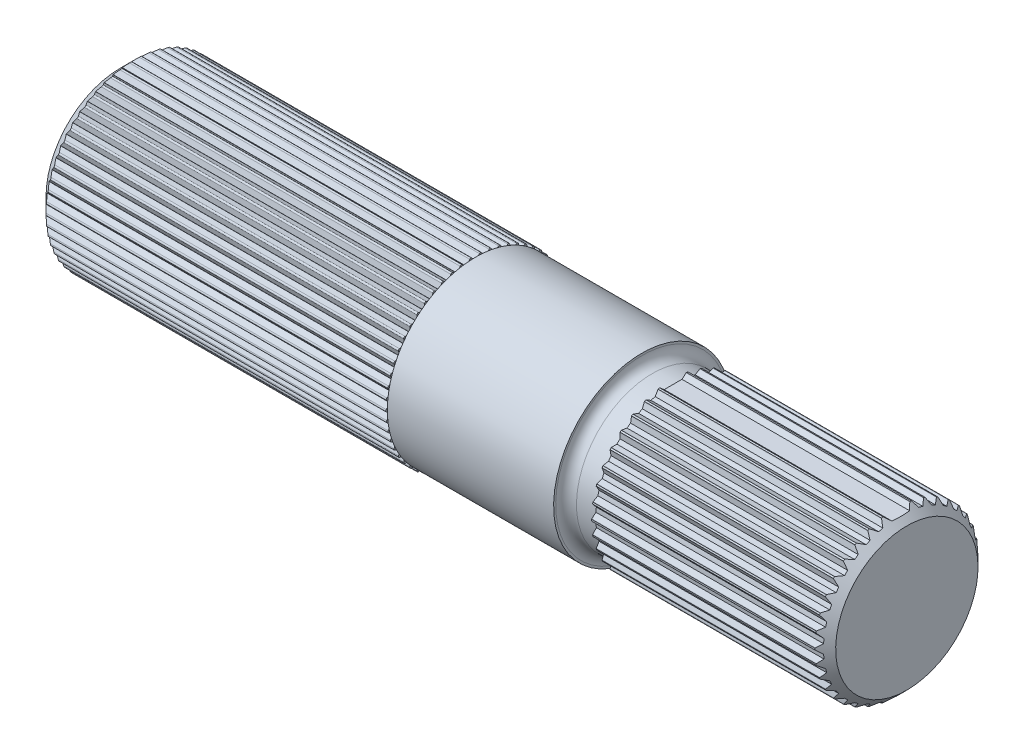
from build123d import *

# Parameters (mm, degrees)
IZIM2_OUTSIDE_W       = 35.232
IZIM2_OUTSIDE_H       = 35.232
KES_EKSTR_ZYON1_DEPTH = 23
IZIM4_OUTSIDE_W       = 35.232
IZIM4_OUTSIDE_H       = 35.232
KES_EKSTR_ZYON3_DEPTH = 34.2


with BuildPart() as part:
    # Çizim1 → Döndür1 (revolve)
    with BuildSketch(Plane.XY):
        with BuildLine():
            Line((0, 0), (75.7, 0))
            Line((75.7, 0), (75.7, -6.85))
            Line((75.7, -6.85), (74.7, -7.85))
            Line((74.7, -7.85), (53.2, -7.85))
            Line((53.2, -7.85), (53.2, -7.3))
            Line((53.2, -7.3), (51.2, -7.3))
            ThreePointArc((51.2, -7.3), (50.492893219, -7.592893219), (50.2, -8.3))
            Line((50.2, -8.3), (50.2, -8.5))
            Line((50.2, -8.5), (34.2, -8.5))
            Line((34.2, -8.5), (34.2, -8.66))
            Line((34.2, -8.66), (1.5, -8.66))
            Line((1.5, -8.66), (0, -7.16))
            Line((0, -7.16), (0, 0))
        make_face()
    revolve(axis=Axis((0, 0, 0), (1, 0, 0)))

    # Çizim2 outside → Kes-Ekstrüzyon1 (cut)
    with BuildSketch(Plane(origin=(75.7, 0, 0), x_dir=(0, 0, -1), z_dir=(1, 0, 0))):
        Rectangle(IZIM2_OUTSIDE_W, IZIM2_OUTSIDE_H)
        with BuildLine():
            Line((5.932852577, 5.108414624), (5.40374633, 5.108414624))
            ThreePointArc((5.40374633, 5.108414624), (5.258154352, 5.258154352), (5.108414624, 5.40374633))
            Line((5.108414624, 5.40374633), (5.108414624, 5.932852577))
            ThreePointArc((5.108414624, 5.932852577), (5.061919783, 6.032561087), (4.955652325, 6.061035366))
            Line((4.955652325, 6.061035366), (4.434584391, 5.96915703))
            ThreePointArc((4.434584391, 5.96915703), (4.265202251, 6.091340093), (4.092455625, 6.208718171))
            Line((4.092455625, 6.208718171), (4.000577289, 6.729786106))
            ThreePointArc((4.000577289, 6.729786106), (3.937474608, 6.819906075), (3.827877085, 6.829494615))
            Line((3.827877085, 6.829494615), (3.330679849, 6.648529621))
            ThreePointArc((3.330679849, 6.648529621), (3.142654138, 6.739443548), (2.952149432, 6.825041253))
            Line((2.952149432, 6.825041253), (2.771184438, 7.322238489))
            ThreePointArc((2.771184438, 7.322238489), (2.69339126, 7.400031667), (2.583793737, 7.390443126))
            Line((2.583793737, 7.390443126), (2.125574285, 7.125890003))
            ThreePointArc((2.125574285, 7.125890003), (1.92461807, 7.182772421), (1.722143673, 7.23398891))
            Line((1.722143673, 7.23398891), (1.457590549, 7.692208361))
            ThreePointArc((1.457590549, 7.692208361), (1.367470581, 7.755311042), (1.261203123, 7.726836763))
            Line((1.261203123, 7.726836763), (0.855884222, 7.386733823))
            Line((0.855884222, 7.386733823), (-0.855884222, 7.386733823))
            Line((-0.855884222, 7.386733823), (-1.261203123, 7.726836763))
            ThreePointArc((-1.261203123, 7.726836763), (-1.367470581, 7.755311042), (-1.457590549, 7.692208361))
            Line((-1.457590549, 7.692208361), (-1.722143673, 7.23398891))
            ThreePointArc((-1.722143673, 7.23398891), (-1.92461807, 7.182772421), (-2.125574285, 7.125890003))
            Line((-2.125574285, 7.125890003), (-2.583793737, 7.390443126))
            ThreePointArc((-2.583793737, 7.390443126), (-2.69339126, 7.400031667), (-2.771184438, 7.322238489))
            Line((-2.771184438, 7.322238489), (-2.952149432, 6.825041253))
            ThreePointArc((-2.952149432, 6.825041253), (-3.142654138, 6.739443548), (-3.330679849, 6.648529621))
            Line((-3.330679849, 6.648529621), (-3.827877085, 6.829494615))
            ThreePointArc((-3.827877085, 6.829494615), (-3.937474608, 6.819906075), (-4.000577289, 6.729786106))
            Line((-4.000577289, 6.729786106), (-4.092455625, 6.208718171))
            ThreePointArc((-4.092455625, 6.208718171), (-4.265202251, 6.091340093), (-4.434584391, 5.96915703))
            Line((-4.434584391, 5.96915703), (-4.955652325, 6.061035366))
            ThreePointArc((-4.955652325, 6.061035366), (-5.061919783, 6.032561087), (-5.108414624, 5.932852577))
            Line((-5.108414624, 5.932852577), (-5.108414624, 5.40374633))
            ThreePointArc((-5.108414624, 5.40374633), (-5.258154352, 5.258154352), (-5.40374633, 5.108414624))
            Line((-5.40374633, 5.108414624), (-5.932852577, 5.108414624))
            ThreePointArc((-5.932852577, 5.108414624), (-6.032561087, 5.061919783), (-6.061035366, 4.955652325))
            Line((-6.061035366, 4.955652325), (-5.96915703, 4.434584391))
            ThreePointArc((-5.96915703, 4.434584391), (-6.091340093, 4.265202251), (-6.208718171, 4.092455625))
            Line((-6.208718171, 4.092455625), (-6.729786106, 4.000577289))
            ThreePointArc((-6.729786106, 4.000577289), (-6.819906075, 3.937474608), (-6.829494615, 3.827877085))
            Line((-6.829494615, 3.827877085), (-6.648529621, 3.330679849))
            ThreePointArc((-6.648529621, 3.330679849), (-6.739443548, 3.142654138), (-6.825041253, 2.952149432))
            Line((-6.825041253, 2.952149432), (-7.322238489, 2.771184438))
            ThreePointArc((-7.322238489, 2.771184438), (-7.400031667, 2.69339126), (-7.390443126, 2.583793737))
            Line((-7.390443126, 2.583793737), (-7.125890003, 2.125574285))
            ThreePointArc((-7.125890003, 2.125574285), (-7.182772421, 1.92461807), (-7.23398891, 1.722143673))
            Line((-7.23398891, 1.722143673), (-7.692208361, 1.457590549))
            ThreePointArc((-7.692208361, 1.457590549), (-7.755311042, 1.367470581), (-7.726836763, 1.261203123))
            Line((-7.726836763, 1.261203123), (-7.386733823, 0.855884222))
            ThreePointArc((-7.386733823, 0.855884222), (-7.407856389, 0.648103455), (-7.423135474, 0.439811449))
            Line((-7.423135474, 0.439811449), (-7.828454374, 0.099708509))
            ThreePointArc((-7.828454374, 0.099708509), (-7.874949216, 0), (-7.828454374, -0.099708509))
            Line((-7.828454374, -0.099708509), (-7.423135474, -0.439811449))
            ThreePointArc((-7.423135474, -0.439811449), (-7.407856389, -0.648103455), (-7.386733823, -0.855884222))
            Line((-7.386733823, -0.855884222), (-7.726836763, -1.261203123))
            ThreePointArc((-7.726836763, -1.261203123), (-7.755311042, -1.367470581), (-7.692208361, -1.457590549))
            Line((-7.692208361, -1.457590549), (-7.23398891, -1.722143673))
            ThreePointArc((-7.23398891, -1.722143673), (-7.182772421, -1.92461807), (-7.125890003, -2.125574285))
            Line((-7.125890003, -2.125574285), (-7.390443126, -2.583793737))
            ThreePointArc((-7.390443126, -2.583793737), (-7.400031667, -2.69339126), (-7.322238489, -2.771184438))
            Line((-7.322238489, -2.771184438), (-6.825041253, -2.952149432))
            ThreePointArc((-6.825041253, -2.952149432), (-6.739443548, -3.142654138), (-6.648529621, -3.330679849))
            Line((-6.648529621, -3.330679849), (-6.829494615, -3.827877085))
            ThreePointArc((-6.829494615, -3.827877085), (-6.819906075, -3.937474608), (-6.729786106, -4.000577289))
            Line((-6.729786106, -4.000577289), (-6.208718171, -4.092455625))
            ThreePointArc((-6.208718171, -4.092455625), (-6.091340093, -4.265202251), (-5.96915703, -4.434584391))
            Line((-5.96915703, -4.434584391), (-6.061035366, -4.955652325))
            ThreePointArc((-6.061035366, -4.955652325), (-6.032561087, -5.061919783), (-5.932852577, -5.108414624))
            Line((-5.932852577, -5.108414624), (-5.40374633, -5.108414624))
            ThreePointArc((-5.40374633, -5.108414624), (-5.258154352, -5.258154352), (-5.108414624, -5.40374633))
            Line((-5.108414624, -5.40374633), (-5.108414624, -5.932852577))
            ThreePointArc((-5.108414624, -5.932852577), (-5.061919783, -6.032561087), (-4.955652325, -6.061035366))
            Line((-4.955652325, -6.061035366), (-4.434584391, -5.96915703))
            ThreePointArc((-4.434584391, -5.96915703), (-4.265202251, -6.091340093), (-4.092455625, -6.208718171))
            Line((-4.092455625, -6.208718171), (-4.000577289, -6.729786106))
            ThreePointArc((-4.000577289, -6.729786106), (-3.937474608, -6.819906075), (-3.827877085, -6.829494615))
            Line((-3.827877085, -6.829494615), (-3.330679849, -6.648529621))
            ThreePointArc((-3.330679849, -6.648529621), (-3.142654138, -6.739443548), (-2.952149432, -6.825041253))
            Line((-2.952149432, -6.825041253), (-2.771184438, -7.322238489))
            ThreePointArc((-2.771184438, -7.322238489), (-2.69339126, -7.400031667), (-2.583793737, -7.390443126))
            Line((-2.583793737, -7.390443126), (-2.125574285, -7.125890003))
            ThreePointArc((-2.125574285, -7.125890003), (-1.92461807, -7.182772421), (-1.722143673, -7.23398891))
            Line((-1.722143673, -7.23398891), (-1.457590549, -7.692208361))
            ThreePointArc((-1.457590549, -7.692208361), (-1.367470581, -7.755311042), (-1.261203123, -7.726836763))
            Line((-1.261203123, -7.726836763), (-0.855884222, -7.386733823))
            ThreePointArc((-0.855884222, -7.386733823), (-0.648103455, -7.407856389), (-0.439811449, -7.423135474))
            Line((-0.439811449, -7.423135474), (-0.099708509, -7.828454374))
            ThreePointArc((-0.099708509, -7.828454374), (0, -7.874949216), (0.099708509, -7.828454374))
            Line((0.099708509, -7.828454374), (0.439811449, -7.423135474))
            ThreePointArc((0.439811449, -7.423135474), (0.648103455, -7.407856389), (0.855884222, -7.386733823))
            Line((0.855884222, -7.386733823), (1.261203123, -7.726836763))
            ThreePointArc((1.261203123, -7.726836763), (1.367470581, -7.755311042), (1.457590549, -7.692208361))
            Line((1.457590549, -7.692208361), (1.722143673, -7.23398891))
            ThreePointArc((1.722143673, -7.23398891), (1.92461807, -7.182772421), (2.125574285, -7.125890003))
            Line((2.125574285, -7.125890003), (2.583793737, -7.390443126))
            ThreePointArc((2.583793737, -7.390443126), (2.69339126, -7.400031667), (2.771184438, -7.322238489))
            Line((2.771184438, -7.322238489), (2.952149432, -6.825041253))
            ThreePointArc((2.952149432, -6.825041253), (3.142654138, -6.739443548), (3.330679849, -6.648529621))
            Line((3.330679849, -6.648529621), (3.827877085, -6.829494615))
            ThreePointArc((3.827877085, -6.829494615), (3.937474608, -6.819906075), (4.000577289, -6.729786106))
            Line((4.000577289, -6.729786106), (4.092455625, -6.208718171))
            ThreePointArc((4.092455625, -6.208718171), (4.265202251, -6.091340093), (4.434584391, -5.96915703))
            Line((4.434584391, -5.96915703), (4.955652325, -6.061035366))
            ThreePointArc((4.955652325, -6.061035366), (5.061919783, -6.032561087), (5.108414624, -5.932852577))
            Line((5.108414624, -5.932852577), (5.108414624, -5.40374633))
            ThreePointArc((5.108414624, -5.40374633), (5.258154352, -5.258154352), (5.40374633, -5.108414624))
            Line((5.40374633, -5.108414624), (5.932852577, -5.108414624))
            ThreePointArc((5.932852577, -5.108414624), (6.032561087, -5.061919783), (6.061035366, -4.955652325))
            Line((6.061035366, -4.955652325), (5.96915703, -4.434584391))
            ThreePointArc((5.96915703, -4.434584391), (6.091340093, -4.265202251), (6.208718171, -4.092455625))
            Line((6.208718171, -4.092455625), (6.729786106, -4.000577289))
            ThreePointArc((6.729786106, -4.000577289), (6.819906075, -3.937474608), (6.829494615, -3.827877085))
            Line((6.829494615, -3.827877085), (6.648529621, -3.330679849))
            ThreePointArc((6.648529621, -3.330679849), (6.739443548, -3.142654138), (6.825041253, -2.952149432))
            Line((6.825041253, -2.952149432), (7.322238489, -2.771184438))
            ThreePointArc((7.322238489, -2.771184438), (7.400031667, -2.69339126), (7.390443126, -2.583793737))
            Line((7.390443126, -2.583793737), (7.125890003, -2.125574285))
            ThreePointArc((7.125890003, -2.125574285), (7.182772421, -1.92461807), (7.23398891, -1.722143673))
            Line((7.23398891, -1.722143673), (7.692208361, -1.457590549))
            ThreePointArc((7.692208361, -1.457590549), (7.755311042, -1.367470581), (7.726836763, -1.261203123))
            Line((7.726836763, -1.261203123), (7.386733823, -0.855884222))
            ThreePointArc((7.386733823, -0.855884222), (7.407856389, -0.648103455), (7.423135474, -0.439811449))
            Line((7.423135474, -0.439811449), (7.828454374, -0.099708509))
            ThreePointArc((7.828454374, -0.099708509), (7.874949216, 0), (7.828454374, 0.099708509))
            Line((7.828454374, 0.099708509), (7.423135474, 0.439811449))
            ThreePointArc((7.423135474, 0.439811449), (7.407856389, 0.648103455), (7.386733823, 0.855884222))
            Line((7.386733823, 0.855884222), (7.726836763, 1.261203123))
            ThreePointArc((7.726836763, 1.261203123), (7.755311042, 1.367470581), (7.692208361, 1.457590549))
            Line((7.692208361, 1.457590549), (7.23398891, 1.722143673))
            ThreePointArc((7.23398891, 1.722143673), (7.182772421, 1.92461807), (7.125890003, 2.125574285))
            Line((7.125890003, 2.125574285), (7.390443126, 2.583793737))
            ThreePointArc((7.390443126, 2.583793737), (7.400031667, 2.69339126), (7.322238489, 2.771184438))
            Line((7.322238489, 2.771184438), (6.825041253, 2.952149432))
            ThreePointArc((6.825041253, 2.952149432), (6.739443548, 3.142654138), (6.648529621, 3.330679849))
            Line((6.648529621, 3.330679849), (6.829494615, 3.827877085))
            ThreePointArc((6.829494615, 3.827877085), (6.819906075, 3.937474608), (6.729786106, 4.000577289))
            Line((6.729786106, 4.000577289), (6.208718171, 4.092455625))
            ThreePointArc((6.208718171, 4.092455625), (6.091340093, 4.265202251), (5.96915703, 4.434584391))
            Line((5.96915703, 4.434584391), (6.061035366, 4.955652325))
            ThreePointArc((6.061035366, 4.955652325), (6.032561087, 5.061919783), (5.932852577, 5.108414624))
        make_face(mode=Mode.SUBTRACT)
    extrude(amount=-KES_EKSTR_ZYON1_DEPTH, mode=Mode.SUBTRACT)

    # Çizim4 outside → Kes-Ekstrüzyon3 (cut)
    with BuildSketch(Plane.ZY):
        Rectangle(IZIM4_OUTSIDE_W, IZIM4_OUTSIDE_H)
        with BuildLine():
            Line((-0.36676349, 8.606270821), (-0.005215817, 8.219959157))
            ThreePointArc((-0.005215817, 8.219959157), (0, 8.219960812), (0.005215817, 8.219959157))
            Line((0.005215817, 8.219959157), (0.36676349, 8.606270821))
            ThreePointArc((0.36676349, 8.606270821), (0.468842948, 8.647299364), (0.565888047, 8.595474601))
            Line((0.565888047, 8.595474601), (0.883548673, 8.172337334))
            ThreePointArc((0.883548673, 8.172337334), (0.888734095, 8.17177505), (0.893919158, 8.171209476))
            Line((0.893919158, 8.171209476), (1.29511506, 8.516166384))
            ThreePointArc((1.29511506, 8.516166384), (1.40103209, 8.545917685), (1.491905063, 8.483904301))
            Line((1.491905063, 8.483904301), (1.761954364, 8.028902327))
            ThreePointArc((1.761954364, 8.028902327), (1.767048594, 8.027782696), (1.772142113, 8.026659834))
            Line((1.772142113, 8.026659834), (2.208282591, 8.326217683))
            ThreePointArc((2.208282591, 8.326217683), (2.316795412, 8.344342935), (2.400430857, 8.272867979))
            Line((2.400430857, 8.272867979), (2.619702751, 7.791335781))
            ThreePointArc((2.619702751, 7.791335781), (2.624646065, 7.789671931), (2.629588323, 7.788004944))
            Line((2.629588323, 7.788004944), (3.095560026, 8.038651692))
            ThreePointArc((3.095560026, 8.038651692), (3.205396425, 8.044938394), (3.280813794, 7.964839845))
            Line((3.280813794, 7.964839845), (3.446737518, 7.462422947))
            ThreePointArc((3.446737518, 7.462422947), (3.45147196, 7.460234384), (3.456205013, 7.458042817))
            Line((3.456205013, 7.458042817), (3.946544851, 7.65683986))
            ThreePointArc((3.946544851, 7.65683986), (4.056417096, 7.651214305), (4.122732189, 7.563431245))
            Line((4.122732189, 7.563431245), (4.233362439, 7.046020027))
            ThreePointArc((4.233362439, 7.046020027), (4.237832503, 7.04333241), (4.24230086, 7.040641957))
            Line((4.24230086, 7.040641957), (4.751260046, 7.185258581))
            ThreePointArc((4.751260046, 7.185258581), (4.859879986, 7.167786724), (4.916315319, 7.07334833))
            Line((4.916315319, 7.07334833), (4.970355056, 6.547008964))
            ThreePointArc((4.970355056, 6.547008964), (4.974508333, 6.543853803), (4.978659608, 6.540696007))
            Line((4.978659608, 6.540696007), (5.500271061, 6.629436715))
            ThreePointArc((5.500271061, 6.629436715), (5.606365226, 6.600323397), (5.652259146, 6.500336872))
            Line((5.652259146, 6.500336872), (5.649074804, 5.971240207))
            ThreePointArc((5.649074804, 5.971240207), (5.652862602, 5.967654493), (5.656648124, 5.964066377))
            Line((5.656648124, 5.964066377), (6.184796427, 5.995890765))
            ThreePointArc((6.184796427, 5.995890765), (6.28712096, 5.955477314), (6.321935403, 5.851114908))
            Line((6.321935403, 5.851114908), (6.261564316, 5.325464118))
            ThreePointArc((6.261564316, 5.325464118), (6.264942226, 5.321489891), (6.268317613, 5.317513522))
            Line((6.268317613, 5.317513522), (6.796810709, 5.292048477))
            ThreePointArc((6.796810709, 5.292048477), (6.894165949, 5.240808704), (6.917492747, 5.133293972))
            Line((6.917492747, 5.133293972), (6.800642711, 4.617251832))
            ThreePointArc((6.800642711, 4.617251832), (6.80357113, 4.612935686), (6.806496809, 4.608617682))
            Line((6.806496809, 4.608617682), (7.3291386, 4.52616176))
            ThreePointArc((7.3291386, 4.52616176), (7.420383146, 4.464696403), (7.431948814, 4.355289857))
            Line((7.431948814, 4.355289857), (7.259989788, 3.854906489))
            ThreePointArc((7.259989788, 3.854906489), (7.262434382, 3.850299027), (7.264876053, 3.845690014))
            Line((7.264876053, 3.845690014), (7.775539043, 3.707209934))
            ThreePointArc((7.775539043, 3.707209934), (7.859603134, 3.63623962), (7.859272075, 3.52622395))
            Line((7.859272075, 3.52622395), (7.634220122, 3.047365893))
            ThreePointArc((7.634220122, 3.047365893), (7.636152232, 3.042521132), (7.638081268, 3.037675146))
            Line((7.638081268, 3.037675146), (8.130778399, 2.844794462))
            ThreePointArc((8.130778399, 2.844794462), (8.206676462, 2.765151251), (8.194452558, 2.655816292))
            Line((8.194452558, 2.655816292), (7.918946206, 2.204097717))
            ThreePointArc((7.918946206, 2.204097717), (7.920343179, 2.199072459), (7.921736964, 2.194046315))
            Line((7.921736964, 2.194046315), (8.390691812, 1.949026375))
            ThreePointArc((8.390691812, 1.949026375), (8.457534012, 1.861644012), (8.433560577, 1.754271616))
            Line((8.433560577, 1.754271616), (8.110829885, 1.334988511))
            ThreePointArc((8.110829885, 1.334988511), (8.111675344, 1.329841672), (8.112517536, 1.324694297))
            Line((8.112517536, 1.324694297), (8.552232036, 1.030407737))
            ThreePointArc((8.552232036, 1.030407737), (8.609234709, 0.9363107), (8.573792808, 0.832159709))
            Line((8.573792808, 0.832159709), (8.207621501, 0.450227785))
            ThreePointArc((8.207621501, 0.450227785), (8.207905532, 0.445019707), (8.208186258, 0.439811449))
            Line((8.208186258, 0.439811449), (8.613505159, 0.099708509))
            ThreePointArc((8.613505159, 0.099708509), (8.66, 0), (8.613505159, -0.099708509))
            Line((8.613505159, -0.099708509), (8.208186258, -0.439811449))
            ThreePointArc((8.208186258, -0.439811449), (8.207905532, -0.445019707), (8.207621501, -0.450227785))
            Line((8.207621501, -0.450227785), (8.573792808, -0.832159709))
            ThreePointArc((8.573792808, -0.832159709), (8.609234709, -0.9363107), (8.552232036, -1.030407737))
            Line((8.552232036, -1.030407737), (8.112517536, -1.324694297))
            ThreePointArc((8.112517536, -1.324694297), (8.111675344, -1.329841672), (8.110829885, -1.334988511))
            Line((8.110829885, -1.334988511), (8.433560577, -1.754271616))
            ThreePointArc((8.433560577, -1.754271616), (8.457534012, -1.861644012), (8.390691812, -1.949026375))
            Line((8.390691812, -1.949026375), (7.921736964, -2.194046315))
            ThreePointArc((7.921736964, -2.194046315), (7.920343179, -2.199072459), (7.918946206, -2.204097717))
            Line((7.918946206, -2.204097717), (8.194452558, -2.655816292))
            ThreePointArc((8.194452558, -2.655816292), (8.206676462, -2.765151251), (8.130778399, -2.844794462))
            Line((8.130778399, -2.844794462), (7.638081268, -3.037675146))
            ThreePointArc((7.638081268, -3.037675146), (7.636152232, -3.042521132), (7.634220122, -3.047365893))
            Line((7.634220122, -3.047365893), (7.859272075, -3.52622395))
            ThreePointArc((7.859272075, -3.52622395), (7.859603134, -3.63623962), (7.775539043, -3.707209934))
            Line((7.775539043, -3.707209934), (7.264876053, -3.845690014))
            ThreePointArc((7.264876053, -3.845690014), (7.262434382, -3.850299027), (7.259989788, -3.854906489))
            Line((7.259989788, -3.854906489), (7.431948814, -4.355289857))
            ThreePointArc((7.431948814, -4.355289857), (7.420383146, -4.464696403), (7.3291386, -4.52616176))
            Line((7.3291386, -4.52616176), (6.806496809, -4.608617682))
            ThreePointArc((6.806496809, -4.608617682), (6.80357113, -4.612935686), (6.800642711, -4.617251832))
            Line((6.800642711, -4.617251832), (6.917492747, -5.133293972))
            ThreePointArc((6.917492747, -5.133293972), (6.894165949, -5.240808704), (6.796810709, -5.292048477))
            Line((6.796810709, -5.292048477), (6.268317613, -5.317513522))
            ThreePointArc((6.268317613, -5.317513522), (6.264942226, -5.321489891), (6.261564316, -5.325464118))
            Line((6.261564316, -5.325464118), (6.321935403, -5.851114908))
            ThreePointArc((6.321935403, -5.851114908), (6.28712096, -5.955477314), (6.184796427, -5.995890765))
            Line((6.184796427, -5.995890765), (5.656648124, -5.964066377))
            ThreePointArc((5.656648124, -5.964066377), (5.652862602, -5.967654493), (5.649074804, -5.971240207))
            Line((5.649074804, -5.971240207), (5.652259146, -6.500336872))
            ThreePointArc((5.652259146, -6.500336872), (5.606365226, -6.600323397), (5.500271061, -6.629436715))
            Line((5.500271061, -6.629436715), (4.978659608, -6.540696007))
            ThreePointArc((4.978659608, -6.540696007), (4.974508333, -6.543853803), (4.970355056, -6.547008964))
            Line((4.970355056, -6.547008964), (4.916315319, -7.07334833))
            ThreePointArc((4.916315319, -7.07334833), (4.859879986, -7.167786724), (4.751260046, -7.185258581))
            Line((4.751260046, -7.185258581), (4.24230086, -7.040641957))
            ThreePointArc((4.24230086, -7.040641957), (4.237832503, -7.04333241), (4.233362439, -7.046020027))
            Line((4.233362439, -7.046020027), (4.122732189, -7.563431245))
            ThreePointArc((4.122732189, -7.563431245), (4.056417096, -7.651214305), (3.946544851, -7.65683986))
            Line((3.946544851, -7.65683986), (3.456205013, -7.458042817))
            ThreePointArc((3.456205013, -7.458042817), (3.45147196, -7.460234384), (3.446737518, -7.462422947))
            Line((3.446737518, -7.462422947), (3.280813794, -7.964839845))
            ThreePointArc((3.280813794, -7.964839845), (3.205396425, -8.044938394), (3.095560026, -8.038651692))
            Line((3.095560026, -8.038651692), (2.629588323, -7.788004944))
            ThreePointArc((2.629588323, -7.788004944), (2.624646065, -7.789671931), (2.619702751, -7.791335781))
            Line((2.619702751, -7.791335781), (2.400430857, -8.272867979))
            ThreePointArc((2.400430857, -8.272867979), (2.316795412, -8.344342935), (2.208282591, -8.326217683))
            Line((2.208282591, -8.326217683), (1.772142113, -8.026659834))
            ThreePointArc((1.772142113, -8.026659834), (1.767048594, -8.027782696), (1.761954364, -8.028902327))
            Line((1.761954364, -8.028902327), (1.491905063, -8.483904301))
            ThreePointArc((1.491905063, -8.483904301), (1.40103209, -8.545917685), (1.29511506, -8.516166384))
            Line((1.29511506, -8.516166384), (0.893919158, -8.171209476))
            ThreePointArc((0.893919158, -8.171209476), (0.888734095, -8.17177505), (0.883548673, -8.172337334))
            Line((0.883548673, -8.172337334), (0.565888047, -8.595474601))
            ThreePointArc((0.565888047, -8.595474601), (0.468842948, -8.647299364), (0.36676349, -8.606270821))
            Line((0.36676349, -8.606270821), (0.005215817, -8.219959157))
            ThreePointArc((0.005215817, -8.219959157), (0, -8.219960812), (-0.005215817, -8.219959157))
            Line((-0.005215817, -8.219959157), (-0.36676349, -8.606270821))
            ThreePointArc((-0.36676349, -8.606270821), (-0.468842948, -8.647299364), (-0.565888047, -8.595474601))
            Line((-0.565888047, -8.595474601), (-0.883548673, -8.172337334))
            ThreePointArc((-0.883548673, -8.172337334), (-0.888734095, -8.17177505), (-0.893919158, -8.171209476))
            Line((-0.893919158, -8.171209476), (-1.29511506, -8.516166384))
            ThreePointArc((-1.29511506, -8.516166384), (-1.40103209, -8.545917685), (-1.491905063, -8.483904301))
            Line((-1.491905063, -8.483904301), (-1.761954364, -8.028902327))
            ThreePointArc((-1.761954364, -8.028902327), (-1.767048594, -8.027782696), (-1.772142113, -8.026659834))
            Line((-1.772142113, -8.026659834), (-2.208282591, -8.326217683))
            ThreePointArc((-2.208282591, -8.326217683), (-2.316795412, -8.344342935), (-2.400430857, -8.272867979))
            Line((-2.400430857, -8.272867979), (-2.619702751, -7.791335781))
            ThreePointArc((-2.619702751, -7.791335781), (-2.624646065, -7.789671931), (-2.629588323, -7.788004944))
            Line((-2.629588323, -7.788004944), (-3.095560026, -8.038651692))
            ThreePointArc((-3.095560026, -8.038651692), (-3.205396425, -8.044938394), (-3.280813794, -7.964839845))
            Line((-3.280813794, -7.964839845), (-3.446737518, -7.462422947))
            ThreePointArc((-3.446737518, -7.462422947), (-3.45147196, -7.460234384), (-3.456205013, -7.458042817))
            Line((-3.456205013, -7.458042817), (-3.946544851, -7.65683986))
            ThreePointArc((-3.946544851, -7.65683986), (-4.056417096, -7.651214305), (-4.122732189, -7.563431245))
            Line((-4.122732189, -7.563431245), (-4.233362439, -7.046020027))
            ThreePointArc((-4.233362439, -7.046020027), (-4.237832503, -7.04333241), (-4.24230086, -7.040641957))
            Line((-4.24230086, -7.040641957), (-4.751260046, -7.185258581))
            ThreePointArc((-4.751260046, -7.185258581), (-4.859879986, -7.167786724), (-4.916315319, -7.07334833))
            Line((-4.916315319, -7.07334833), (-4.970355056, -6.547008964))
            ThreePointArc((-4.970355056, -6.547008964), (-4.974508333, -6.543853803), (-4.978659608, -6.540696007))
            Line((-4.978659608, -6.540696007), (-5.500271061, -6.629436715))
            ThreePointArc((-5.500271061, -6.629436715), (-5.606365226, -6.600323397), (-5.652259146, -6.500336872))
            Line((-5.652259146, -6.500336872), (-5.649074804, -5.971240207))
            ThreePointArc((-5.649074804, -5.971240207), (-5.652862602, -5.967654493), (-5.656648124, -5.964066377))
            Line((-5.656648124, -5.964066377), (-6.184796427, -5.995890765))
            ThreePointArc((-6.184796427, -5.995890765), (-6.28712096, -5.955477314), (-6.321935403, -5.851114908))
            Line((-6.321935403, -5.851114908), (-6.261564316, -5.325464118))
            ThreePointArc((-6.261564316, -5.325464118), (-6.264942226, -5.321489891), (-6.268317613, -5.317513522))
            Line((-6.268317613, -5.317513522), (-6.796810709, -5.292048477))
            ThreePointArc((-6.796810709, -5.292048477), (-6.894165949, -5.240808704), (-6.917492747, -5.133293972))
            Line((-6.917492747, -5.133293972), (-6.800642711, -4.617251832))
            ThreePointArc((-6.800642711, -4.617251832), (-6.80357113, -4.612935686), (-6.806496809, -4.608617682))
            Line((-6.806496809, -4.608617682), (-7.3291386, -4.52616176))
            ThreePointArc((-7.3291386, -4.52616176), (-7.420383146, -4.464696403), (-7.431948814, -4.355289857))
            Line((-7.431948814, -4.355289857), (-7.259989788, -3.854906489))
            ThreePointArc((-7.259989788, -3.854906489), (-7.262434382, -3.850299027), (-7.264876053, -3.845690014))
            Line((-7.264876053, -3.845690014), (-7.775539043, -3.707209934))
            ThreePointArc((-7.775539043, -3.707209934), (-7.859603134, -3.63623962), (-7.859272075, -3.52622395))
            Line((-7.859272075, -3.52622395), (-7.634220122, -3.047365893))
            ThreePointArc((-7.634220122, -3.047365893), (-7.636152232, -3.042521132), (-7.638081268, -3.037675146))
            Line((-7.638081268, -3.037675146), (-8.130778399, -2.844794462))
            ThreePointArc((-8.130778399, -2.844794462), (-8.206676462, -2.765151251), (-8.194452558, -2.655816292))
            Line((-8.194452558, -2.655816292), (-7.918946206, -2.204097717))
            ThreePointArc((-7.918946206, -2.204097717), (-7.920343179, -2.199072459), (-7.921736964, -2.194046315))
            Line((-7.921736964, -2.194046315), (-8.390691812, -1.949026375))
            ThreePointArc((-8.390691812, -1.949026375), (-8.457534012, -1.861644012), (-8.433560577, -1.754271616))
            Line((-8.433560577, -1.754271616), (-8.110829885, -1.334988511))
            ThreePointArc((-8.110829885, -1.334988511), (-8.111675344, -1.329841672), (-8.112517536, -1.324694297))
            Line((-8.112517536, -1.324694297), (-8.552232036, -1.030407737))
            ThreePointArc((-8.552232036, -1.030407737), (-8.609234709, -0.9363107), (-8.573792808, -0.832159709))
            Line((-8.573792808, -0.832159709), (-8.207621501, -0.450227785))
            ThreePointArc((-8.207621501, -0.450227785), (-8.207905532, -0.445019707), (-8.208186258, -0.439811449))
            Line((-8.208186258, -0.439811449), (-8.613505159, -0.099708509))
            ThreePointArc((-8.613505159, -0.099708509), (-8.66, 0), (-8.613505159, 0.099708509))
            Line((-8.613505159, 0.099708509), (-8.208186258, 0.439811449))
            ThreePointArc((-8.208186258, 0.439811449), (-8.207905532, 0.445019707), (-8.207621501, 0.450227785))
            Line((-8.207621501, 0.450227785), (-8.573792808, 0.832159709))
            ThreePointArc((-8.573792808, 0.832159709), (-8.609234709, 0.9363107), (-8.552232036, 1.030407737))
            Line((-8.552232036, 1.030407737), (-8.112517536, 1.324694297))
            ThreePointArc((-8.112517536, 1.324694297), (-8.111675344, 1.329841672), (-8.110829885, 1.334988511))
            Line((-8.110829885, 1.334988511), (-8.433560577, 1.754271616))
            ThreePointArc((-8.433560577, 1.754271616), (-8.457534012, 1.861644012), (-8.390691812, 1.949026375))
            Line((-8.390691812, 1.949026375), (-7.921736964, 2.194046315))
            ThreePointArc((-7.921736964, 2.194046315), (-7.920343179, 2.199072459), (-7.918946206, 2.204097717))
            Line((-7.918946206, 2.204097717), (-8.194452558, 2.655816292))
            ThreePointArc((-8.194452558, 2.655816292), (-8.206676462, 2.765151251), (-8.130778399, 2.844794462))
            Line((-8.130778399, 2.844794462), (-7.638081268, 3.037675146))
            ThreePointArc((-7.638081268, 3.037675146), (-7.636152232, 3.042521132), (-7.634220122, 3.047365893))
            Line((-7.634220122, 3.047365893), (-7.859272075, 3.52622395))
            ThreePointArc((-7.859272075, 3.52622395), (-7.859603134, 3.63623962), (-7.775539043, 3.707209934))
            Line((-7.775539043, 3.707209934), (-7.264876053, 3.845690014))
            ThreePointArc((-7.264876053, 3.845690014), (-7.262434382, 3.850299027), (-7.259989788, 3.854906489))
            Line((-7.259989788, 3.854906489), (-7.431948814, 4.355289857))
            ThreePointArc((-7.431948814, 4.355289857), (-7.420383146, 4.464696403), (-7.3291386, 4.52616176))
            Line((-7.3291386, 4.52616176), (-6.806496809, 4.608617682))
            ThreePointArc((-6.806496809, 4.608617682), (-6.80357113, 4.612935686), (-6.800642711, 4.617251832))
            Line((-6.800642711, 4.617251832), (-6.917492747, 5.133293972))
            ThreePointArc((-6.917492747, 5.133293972), (-6.894165949, 5.240808704), (-6.796810709, 5.292048477))
            Line((-6.796810709, 5.292048477), (-6.268317613, 5.317513522))
            ThreePointArc((-6.268317613, 5.317513522), (-6.264942226, 5.321489891), (-6.261564316, 5.325464118))
            Line((-6.261564316, 5.325464118), (-6.321935403, 5.851114908))
            ThreePointArc((-6.321935403, 5.851114908), (-6.28712096, 5.955477314), (-6.184796427, 5.995890765))
            Line((-6.184796427, 5.995890765), (-5.656648124, 5.964066377))
            ThreePointArc((-5.656648124, 5.964066377), (-5.652862602, 5.967654493), (-5.649074804, 5.971240207))
            Line((-5.649074804, 5.971240207), (-5.652259146, 6.500336872))
            ThreePointArc((-5.652259146, 6.500336872), (-5.606365226, 6.600323397), (-5.500271061, 6.629436715))
            Line((-5.500271061, 6.629436715), (-4.978659608, 6.540696007))
            ThreePointArc((-4.978659608, 6.540696007), (-4.974508333, 6.543853803), (-4.970355056, 6.547008964))
            Line((-4.970355056, 6.547008964), (-4.916315319, 7.07334833))
            ThreePointArc((-4.916315319, 7.07334833), (-4.859879986, 7.167786724), (-4.751260046, 7.185258581))
            Line((-4.751260046, 7.185258581), (-4.24230086, 7.040641957))
            ThreePointArc((-4.24230086, 7.040641957), (-4.237832503, 7.04333241), (-4.233362439, 7.046020027))
            Line((-4.233362439, 7.046020027), (-4.122732189, 7.563431245))
            ThreePointArc((-4.122732189, 7.563431245), (-4.056417096, 7.651214305), (-3.946544851, 7.65683986))
            Line((-3.946544851, 7.65683986), (-3.456205013, 7.458042817))
            ThreePointArc((-3.456205013, 7.458042817), (-3.45147196, 7.460234384), (-3.446737518, 7.462422947))
            Line((-3.446737518, 7.462422947), (-3.280813794, 7.964839845))
            ThreePointArc((-3.280813794, 7.964839845), (-3.205396425, 8.044938394), (-3.095560026, 8.038651692))
            Line((-3.095560026, 8.038651692), (-2.629588323, 7.788004944))
            ThreePointArc((-2.629588323, 7.788004944), (-2.624646065, 7.789671931), (-2.619702751, 7.791335781))
            Line((-2.619702751, 7.791335781), (-2.400430857, 8.272867979))
            ThreePointArc((-2.400430857, 8.272867979), (-2.316795412, 8.344342935), (-2.208282591, 8.326217683))
            Line((-2.208282591, 8.326217683), (-1.772142113, 8.026659834))
            ThreePointArc((-1.772142113, 8.026659834), (-1.767048594, 8.027782696), (-1.761954364, 8.028902327))
            Line((-1.761954364, 8.028902327), (-1.491905063, 8.483904301))
            ThreePointArc((-1.491905063, 8.483904301), (-1.40103209, 8.545917685), (-1.29511506, 8.516166384))
            Line((-1.29511506, 8.516166384), (-0.893919158, 8.171209476))
            ThreePointArc((-0.893919158, 8.171209476), (-0.888734095, 8.17177505), (-0.883548673, 8.172337334))
            Line((-0.883548673, 8.172337334), (-0.565888047, 8.595474601))
            ThreePointArc((-0.565888047, 8.595474601), (-0.468842948, 8.647299364), (-0.36676349, 8.606270821))
        make_face(mode=Mode.SUBTRACT)
    extrude(amount=-KES_EKSTR_ZYON3_DEPTH, mode=Mode.SUBTRACT)


solid = part.part
